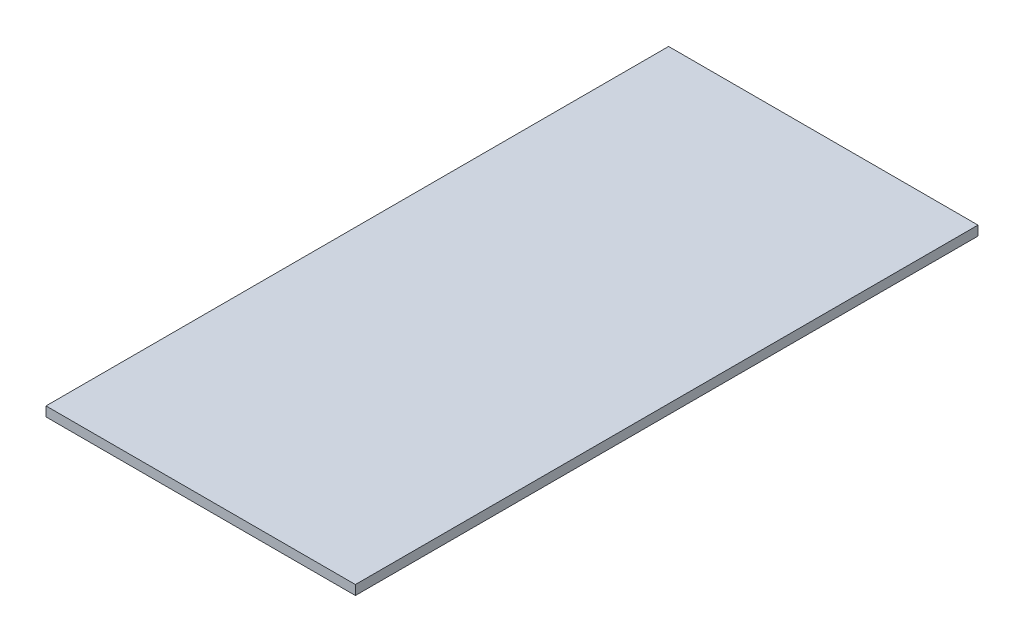
from build123d import *

# Parameters (mm, degrees)
SKETCH1_W           = 102.87
SKETCH1_H           = 207.01
BOSS_EXTRUDE1_DEPTH = 3.175


with BuildPart() as part:
    # Sketch1 → Boss-Extrude1 (new body)
    with BuildSketch(Plane(origin=(0, 0, 0), x_dir=(1, 0, 0), z_dir=(0, 1, 0))):
        with Locations((51.435, 103.505)):
            Rectangle(SKETCH1_W, SKETCH1_H)
    extrude(amount=BOSS_EXTRUDE1_DEPTH)


solid = part.part
